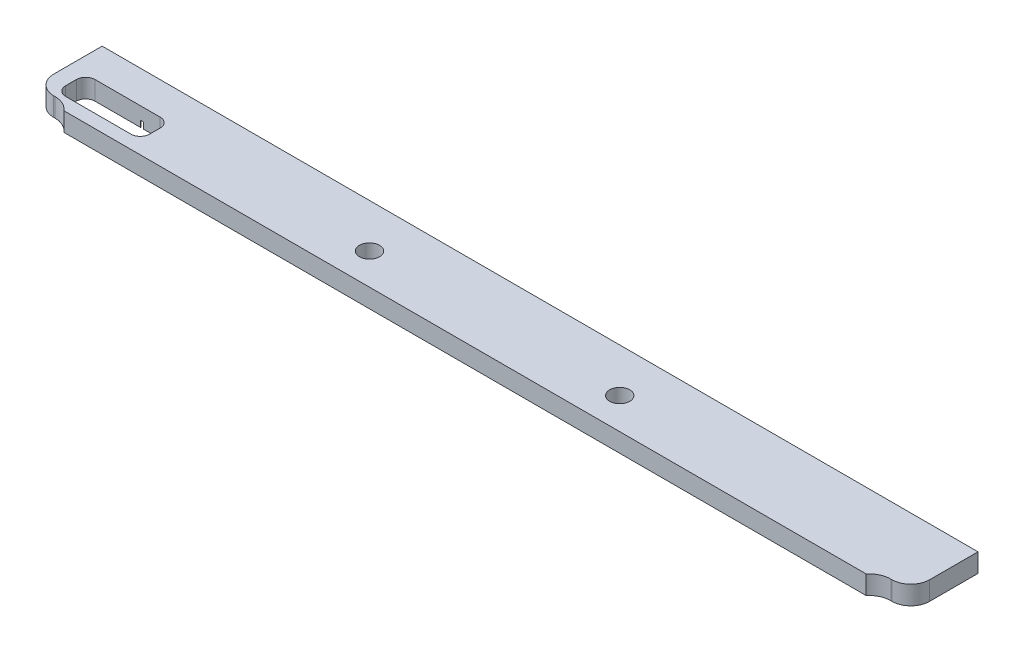
from build123d import *

# Parameters (mm, degrees)
BOSS_EXTRUDE1_DEPTH = 3
CUT_EXTRUDE1_DEPTH  = 1
CUT_EXTRUDE3_REACH  = 138.82
CUT_EXTRUDE4_REACH  = 138.82


with BuildPart() as part:
    # Sketch3 → Boss-Extrude1 (new body)
    with BuildSketch(Plane(origin=(0, 0, 0), x_dir=(1, 0, 0), z_dir=(0, 1, 0))):
        with BuildLine():
            Line((131.37466785, -26.093767651), (-8.62533215, -26.093767651))
            Line((-8.62533215, -26.093767651), (-8.62533215, -33.834747513))
            ThreePointArc((-8.62533215, -33.834747513), (-7.746652493, -35.956067857), (-5.62533215, -36.834747513))
            Line((-5.62533215, -36.834747513), (-5.431022837, -36.834747513))
            ThreePointArc((-5.431022837, -36.834747513), (-3.945556452, -37.165616778), (-2.74094445, -38.095667731))
            Line((-2.74094445, -38.095667731), (125.49028015, -38.095667731))
            ThreePointArc((125.49028015, -38.095667731), (126.694892152, -37.165616778), (128.180358538, -36.834747513))
            Line((128.180358538, -36.834747513), (128.37466785, -36.834747513))
            ThreePointArc((128.37466785, -36.834747513), (130.495988194, -35.956067857), (131.37466785, -33.834747513))
            Line((131.37466785, -33.834747513), (131.37466785, -26.093767651))
        make_face()
    extrude(amount=BOSS_EXTRUDE1_DEPTH)

    # Sketch4 → Cut-Extrude1 (cut)
    with BuildSketch(Plane.XZ):
        with BuildLine():
            Line((2.050442501, 32.498814854), (1.736339937, 32.498814854))
            add(Edge.make_bspline(
                [(1.736339937, 32.498814854), (1.73838709, 32.540485742), (1.742407644, 32.622326256), (1.761235933, 32.741650163), (1.78817681, 32.855704962), (1.826268264, 32.963574876), (1.873574542, 33.066213683), (1.930304569, 33.163213699), (1.99749842, 33.254204887), (2.073705154, 33.338343731), (2.156473793, 33.415531301), (2.245779732, 33.482186544), (2.33962476, 33.538504215), (2.437724159, 33.585585457), (2.541184722, 33.620925303), (2.64906758, 33.647146943), (2.761846716, 33.662923289), (2.838686738, 33.664619074), (2.877766219, 33.665481521)],
                knots=[0, 0, 0, 0, 1.10065271, 2.161652631, 3.183658789, 4.190468796, 5.17591951, 6.163126047, 7.15150782, 8.156236427, 9.156009102, 10.134482811, 11.092018607, 12.041330605, 13.001268258, 13.972401359, 14.968799086, 16, 16, 16, 16], degree=3))
            add(Edge.make_bspline(
                [(2.877766219, 33.665481521), (2.916144293, 33.664583064), (2.991555837, 33.66281763), (3.101617852, 33.6476566), (3.206395146, 33.623911009), (3.305682913, 33.590595592), (3.398688977, 33.545811165), (3.486112022, 33.492013626), (3.568992833, 33.429793795), (3.643599616, 33.356539981), (3.712107696, 33.278337597), (3.771209951, 33.194849693), (3.821823114, 33.108620408), (3.864010794, 33.018992206), (3.895066933, 32.925121178), (3.918645141, 32.828373975), (3.931972555, 32.727749164), (3.934017978, 32.659642608), (3.935057885, 32.625016777)],
                knots=[0, 0, 0, 0, 1.111607364, 2.184268762, 3.212621178, 4.221274766, 5.211760367, 6.196651075, 7.1921475, 8.207485113, 9.220403448, 10.201281604, 11.166441695, 12.114753415, 13.065576456, 14.026450734, 14.996634279, 16, 16, 16, 16], degree=3))
            add(Edge.make_bspline(
                [(3.935057885, 32.625016777), (3.93337124, 32.576266968), (3.930027549, 32.47962284), (3.901171846, 32.337418482), (3.856589749, 32.199513423), (3.80251672, 32.088534371), (3.747896152, 31.999557478), (3.699716357, 31.925641836), (3.642064004, 31.84681542), (3.575466591, 31.762284311), (3.500928784, 31.671789941), (3.417914117, 31.575295175), (3.325788426, 31.47382487), (3.261130244, 31.404519057), (3.227625994, 31.368606521)],
                knots=[0, 0, 0, 0, 1.184203166, 2.347625244, 3.513805382, 4.700623107, 5.337941753, 6.051866363, 6.845199593, 7.711357327, 8.668078039, 9.695487809, 10.805859518, 12, 12, 12, 12], degree=3))
            Line((3.227625994, 31.368606521), (2.351924872, 30.43471229))
            Line((2.351924872, 30.43471229), (3.97992968, 30.43471229))
            Line((3.97992968, 30.43471229), (3.97992968, 30.075737931))
            Line((3.97992968, 30.075737931), (1.601724552, 30.075737931))
            Line((1.601724552, 30.075737931), (2.959096347, 31.524255559))
            add(Edge.make_bspline(
                [(2.959096347, 31.524255559), (2.992144234, 31.558753866), (3.055622461, 31.625018052), (3.145405038, 31.721761013), (3.226044026, 31.811510553), (3.298061419, 31.894097102), (3.359894924, 31.97072867), (3.414767156, 32.038923373), (3.458732747, 32.101677823), (3.506448143, 32.174418437), (3.552662124, 32.263230755), (3.59237448, 32.371764444), (3.616589329, 32.483491696), (3.619494164, 32.558993734), (3.620955321, 32.596971905)],
                knots=[0, 0, 0, 0, 1.329631726, 2.553950428, 3.673215718, 4.687767853, 5.603093632, 6.413772471, 7.123043292, 7.734684054, 8.834405432, 9.900288307, 10.943827018, 12, 12, 12, 12], degree=3))
            add(Edge.make_bspline(
                [(3.620955321, 32.596971905), (3.620319579, 32.620853304), (3.619066653, 32.667918954), (3.608008955, 32.736924713), (3.591298449, 32.803489527), (3.567353191, 32.867818146), (3.535746451, 32.929263798), (3.497273071, 32.987901278), (3.452883008, 33.044590244), (3.401531739, 33.097743542), (3.345120219, 33.146424747), (3.285525969, 33.189548833), (3.222475865, 33.225587943), (3.156235743, 33.255131441), (3.086990273, 33.278306822), (3.014605528, 33.294365401), (2.939281512, 33.304447885), (2.887848016, 33.305812057), (2.861640417, 33.306507162)],
                knots=[0, 0, 0, 0, 0.991446411, 1.95395049, 2.89581595, 3.838931463, 4.798493298, 5.75982156, 6.748411868, 7.785213223, 8.824556874, 9.840280684, 10.836137867, 11.835679398, 12.848801643, 13.863922112, 14.911575587, 16, 16, 16, 16], degree=3))
            add(Edge.make_bspline(
                [(2.861640417, 33.306507162), (2.834269585, 33.30579213), (2.780517788, 33.304387924), (2.701598755, 33.29456526), (2.626312978, 33.27761942), (2.554471075, 33.254442745), (2.485951489, 33.224984197), (2.421087445, 33.188292452), (2.360024556, 33.144508959), (2.302648033, 33.094868403), (2.249784053, 33.039600801), (2.203337178, 32.977990838), (2.162753163, 32.911163423), (2.12734393, 32.839298872), (2.09858824, 32.761745092), (2.076615089, 32.678777387), (2.059228243, 32.590756006), (2.053419722, 32.529970921), (2.050442501, 32.498814854)],
                knots=[0, 0, 0, 0, 1.031018746, 2.02475058, 2.990194455, 3.934040569, 4.864654155, 5.795059489, 6.735614925, 7.690564532, 8.649604399, 9.611025574, 10.590972636, 11.591080095, 12.624614302, 13.701020113, 14.821632451, 16, 16, 16, 16], degree=3))
        make_face()
    extrude(amount=-CUT_EXTRUDE1_DEPTH, mode=Mode.SUBTRACT)

    # Sketch5 → Cut-Extrude3 (cut, up to next)
    with BuildSketch(Plane(origin=(0, 3, 0), x_dir=(1, 0, 0), z_dir=(0, 1, 0)), mode=Mode.PRIVATE) as cut_extrude3_sk1:
        with BuildLine():
            Line((-4.565790678, -35.977380503), (5.852113338, -35.977380503))
            ThreePointArc((5.852113338, -35.977380503), (6.91277351, -35.538040675), (7.352113338, -34.477380503))
            Line((7.352113338, -34.477380503), (7.352113338, -32.785571201))
            ThreePointArc((7.352113338, -32.785571201), (6.91277351, -31.724911029), (5.852113338, -31.285571201))
            Line((5.852113338, -31.285571201), (-4.565790678, -31.285571201))
            ThreePointArc((-4.565790678, -31.285571201), (-5.62645085, -31.724911029), (-6.065790678, -32.785571201))
            Line((-6.065790678, -32.785571201), (-6.065790678, -34.477380503))
            ThreePointArc((-6.065790678, -34.477380503), (-5.62645085, -35.538040675), (-4.565790678, -35.977380503))
        make_face()
    cut_extrude3_tool1 = extrude(cut_extrude3_sk1.sketch, amount=-CUT_EXTRUDE3_REACH, mode=Mode.PRIVATE) & part.part
    add(cut_extrude3_tool1.solids().sort_by_distance((0.643161, 3, 33.631476))[0], mode=Mode.SUBTRACT)

    # Sketch6 → Cut-Extrude4 (cut, up to next)
    with BuildSketch(Plane(origin=(0, 3, 0), x_dir=(1, 0, 0), z_dir=(0, 1, 0)), mode=Mode.PRIVATE) as cut_extrude4_sk1:
        with BuildLine():
            ThreePointArc((41.109797099, -31.496885933), (39.509797099, -33.096885933), (41.109797099, -34.696885933))
            ThreePointArc((41.109797099, -34.696885933), (42.709797099, -33.096885933), (41.109797099, -31.496885933))
        make_face()
    cut_extrude4_tool1 = extrude(cut_extrude4_sk1.sketch, amount=-CUT_EXTRUDE4_REACH, mode=Mode.PRIVATE) & part.part
    # Sketch6 → Cut-Extrude4 (cut, up to next)
    with BuildSketch(Plane(origin=(0, 3, 0), x_dir=(1, 0, 0), z_dir=(0, 1, 0)), mode=Mode.PRIVATE) as cut_extrude4_sk2:
        with BuildLine():
            ThreePointArc((81.109797099, -31.496885933), (79.509797099, -33.096885933), (81.109797099, -34.696885933))
            ThreePointArc((81.109797099, -34.696885933), (82.709797099, -33.096885933), (81.109797099, -31.496885933))
        make_face()
    cut_extrude4_tool2 = extrude(cut_extrude4_sk2.sketch, amount=-CUT_EXTRUDE4_REACH, mode=Mode.PRIVATE) & part.part
    add(cut_extrude4_tool1.solids().sort_by_distance((41.109797, 3, 33.096886))[0], mode=Mode.SUBTRACT)
    add(cut_extrude4_tool2.solids().sort_by_distance((81.109797, 3, 33.096886))[0], mode=Mode.SUBTRACT)


solid = part.part
